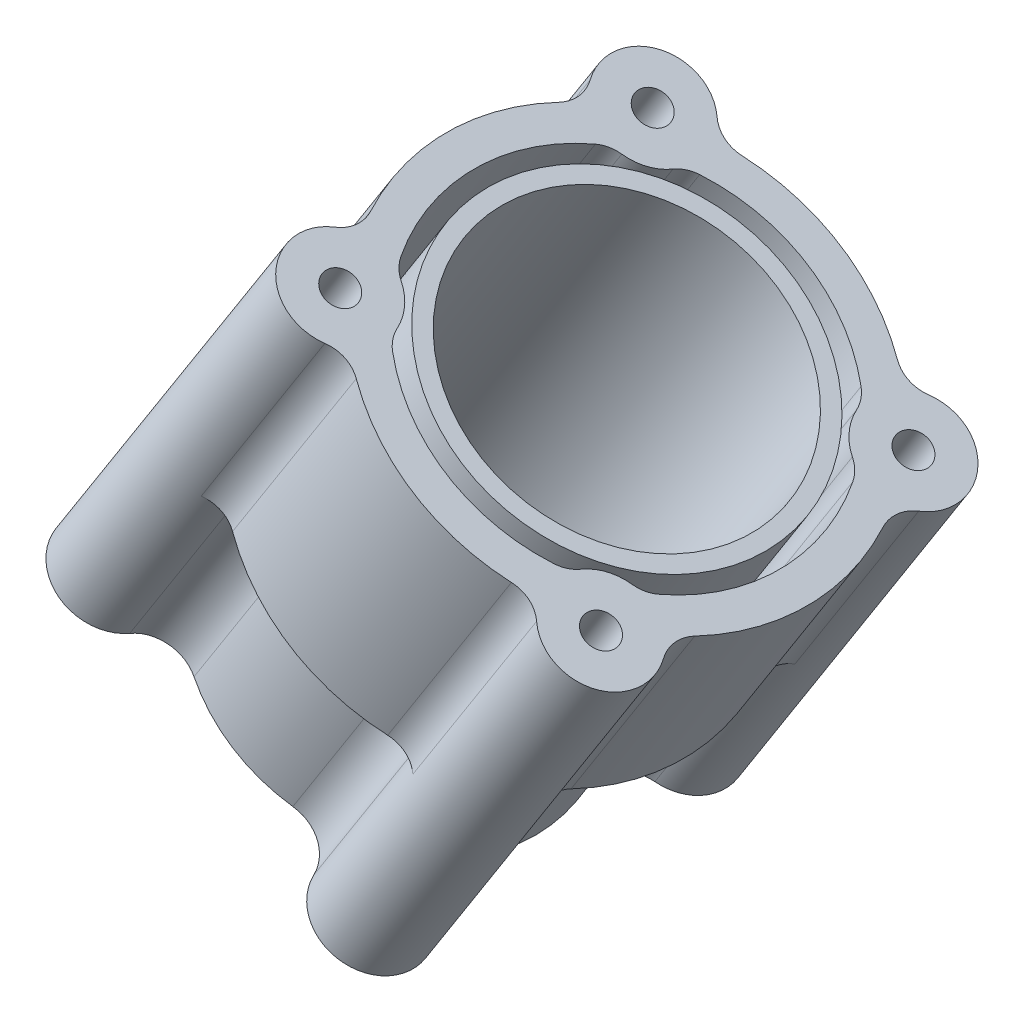
from build123d import *
from build123d.topology import SkipClean

# Parameters (mm, degrees)
BOSS_EXTRUDE1_START   = 100
SKETCH2_R             = 5
BOSS_EXTRUDE1_DEPTH   = 130
SKETCH2_R_2           = 50
SKETCH2_R_3           = 45
BOSS_EXTRUDE1_2_DEPTH = 130
SKETCH3_R             = 100
SKETCH3_R_2           = 50
CUT_EXTRUDE1_DEPTH    = 60
BOSS_EXTRUDE3_START   = 60
SKETCH4_R             = 5
BOSS_EXTRUDE3_DEPTH   = 60


with BuildPart() as part:
    # Sketch2 → Boss-Extrude1 (new body)
    with BuildSketch(Plane(origin=(0, 0, 0), x_dir=(0, 0, -1), z_dir=(0.5372996083468277, 0.8433914458128833, 0)).offset(BOSS_EXTRUDE1_START)):
        with BuildLine():
            ThreePointArc((198.707774346, 59.213708116), (179.337427943, 57.550334456), (177.879118885, 38.163471214))
            ThreePointArc((177.879118885, 38.163471214), (179.755724079, 33.196743881), (178.825393945, 27.96945842))
            ThreePointArc((178.825393945, 27.96945842), (172.5, 0), (178.825393945, -27.96945842))
            ThreePointArc((178.825393945, -27.96945842), (179.755724079, -33.196743881), (177.879118885, -38.163471214))
            ThreePointArc((177.879118885, -38.163471214), (179.337427943, -57.550334456), (198.707774346, -59.213708116))
            ThreePointArc((198.707774346, -59.213708116), (203.694081302, -57.389764479), (208.911229611, -58.375356167))
            ThreePointArc((208.911229611, -58.375356167), (237.5, -65), (266.088770389, -58.375356167))
            ThreePointArc((266.088770389, -58.375356167), (271.305918698, -57.389764479), (276.292225654, -59.213708116))
            ThreePointArc((276.292225654, -59.213708116), (295.662572057, -57.550334456), (297.120881115, -38.163471214))
            ThreePointArc((297.120881115, -38.163471214), (295.244275921, -33.196743881), (296.174606055, -27.96945842))
            ThreePointArc((296.174606055, -27.96945842), (302.5, 0), (296.174606055, 27.96945842))
            ThreePointArc((296.174606055, 27.96945842), (295.244275921, 33.196743881), (297.120881115, 38.163471214))
            ThreePointArc((297.120881115, 38.163471214), (295.662572057, 57.550334456), (276.292225654, 59.213708116))
            ThreePointArc((276.292225654, 59.213708116), (271.305918698, 57.389764479), (266.088770389, 58.375356167))
            ThreePointArc((266.088770389, 58.375356167), (237.5, 65), (208.911229611, 58.375356167))
            ThreePointArc((208.911229611, 58.375356167), (203.694081302, 57.389764479), (198.707774346, 59.213708116))
        make_face()
        with Locations(Location((190, -47, 0), (0, 0, 90))):
            Circle(SKETCH2_R, mode=Mode.SUBTRACT)
        with Locations(Location((285, -47, 0), (0, 0, 90))):
            Circle(SKETCH2_R, mode=Mode.SUBTRACT)
        with Locations(Location((190, 47, 0), (0, 0, 90))):
            Circle(SKETCH2_R, mode=Mode.SUBTRACT)
        with Locations(Location((285, 47, 0), (0, 0, 90))):
            Circle(SKETCH2_R, mode=Mode.SUBTRACT)
        with BuildLine():
            ThreePointArc((195.584219919, 33.078200982), (192.883806526, 31.461344995), (190.819707243, 29.085224223))
            ThreePointArc((190.819707243, 29.085224223), (182.5, 0), (190.819707243, -29.085224223))
            ThreePointArc((190.819707243, -29.085224223), (192.883806526, -31.461344995), (195.584219919, -33.078200982))
            ThreePointArc((195.584219919, -33.078200982), (200.662572057, -36.449665544), (203.980110186, -41.56340923))
            ThreePointArc((203.980110186, -41.56340923), (205.568300645, -44.280780541), (207.922446674, -46.369907691))
            ThreePointArc((207.922446674, -46.369907691), (237.5, -55), (267.077553326, -46.369907691))
            ThreePointArc((267.077553326, -46.369907691), (269.431699355, -44.280780541), (271.019889814, -41.56340923))
            ThreePointArc((271.019889814, -41.56340923), (274.337427943, -36.449665544), (279.415780081, -33.078200982))
            ThreePointArc((279.415780081, -33.078200982), (282.116193474, -31.461344995), (284.180292757, -29.085224223))
            ThreePointArc((284.180292757, -29.085224223), (292.5, 0), (284.180292757, 29.085224223))
            ThreePointArc((284.180292757, 29.085224223), (282.116193474, 31.461344995), (279.415780081, 33.078200982))
            ThreePointArc((279.415780081, 33.078200982), (274.337427943, 36.449665544), (271.019889814, 41.56340923))
            ThreePointArc((271.019889814, 41.56340923), (269.431699355, 44.280780541), (267.077553326, 46.369907691))
            ThreePointArc((267.077553326, 46.369907691), (237.5, 55), (207.922446674, 46.369907691))
            ThreePointArc((207.922446674, 46.369907691), (205.568300645, 44.280780541), (203.980110186, 41.56340923))
            ThreePointArc((203.980110186, 41.56340923), (200.662572057, 36.449665544), (195.584219919, 33.078200982))
        make_face(mode=Mode.SUBTRACT)
    extrude(amount=BOSS_EXTRUDE1_DEPTH)

    # Sketch3 → Cut-Extrude1 (cut)
    with BuildSketch(Plane(origin=(53.729960835, 84.339144581, 0), x_dir=(0.8433914458128833, -0.5372996083468277, 0), z_dir=(-0.5372996083468277, -0.8433914458128833, 0))):
        with Locations((0, -237.5)):
            Circle(SKETCH3_R)
        with Locations(Location((0, -237.5, 0), (0, 0, 180))):
            Circle(SKETCH3_R_2, mode=Mode.SUBTRACT)
    extrude(amount=-CUT_EXTRUDE1_DEPTH, mode=Mode.SUBTRACT)



with BuildPart() as body_2:
    # Sketch2 → Boss-Extrude1 2 (new body)
    with BuildSketch(Plane(origin=(0, 0, 0), x_dir=(0, 0, -1), z_dir=(0.5372996083468277, 0.8433914458128833, 0)).offset(BOSS_EXTRUDE1_START)):
        with Locations(Location((237.5, 0, 0), (0, 0, 90))):
            Circle(SKETCH2_R_2)
        with Locations(Location((237.5, 0, 0), (0, 0, 90))):
            Circle(SKETCH2_R_3, mode=Mode.SUBTRACT)
    extrude(amount=BOSS_EXTRUDE1_2_DEPTH)


with BuildPart() as part_1:
    with SkipClean():  # the faces are left unmerged after this step: merging them gives an invalid solid
        add(part.part)

        add(body_2.part)  # Boss-Extrude3 merges body 2
        # Sketch4 → Boss-Extrude3 (add)
        # profile 1 of 4: a face of its own
        with BuildSketch(Plane(origin=(85.967937335, 134.94263133, 0), x_dir=(0.8433914458128833, -0.5372996083468277, 0), z_dir=(-0.5372996083468277, -0.8433914458128833, 0)).offset(BOSS_EXTRUDE3_START)):
            with BuildLine():
                ThreePointArc((-33.164183333, -184.206022338), (-57.550334456, -179.337427943), (-52.940059929, -203.773731813))
                ThreePointArc((-52.940059929, -203.773731813), (-46.613065404, -210.182422478), (-46.525893445, -219.187675212))
                ThreePointArc((-46.525893445, -219.187675212), (-35.16778152, -201.958093144), (-17.818975805, -190.782935652))
                ThreePointArc((-17.818975805, -190.782935652), (-26.822801925, -190.600477562), (-33.164183333, -184.206022338))
            make_face()
            with Locations(Location((-47, -190, 0), (0, 0, 180))):
                Circle(SKETCH4_R, mode=Mode.SUBTRACT)
        # profile 2 of 4: a face of its own
        with BuildSketch(Plane(origin=(85.967937335, 134.94263133, 0), x_dir=(0.8433914458128833, -0.5372996083468277, 0), z_dir=(-0.5372996083468277, -0.8433914458128833, 0)).offset(BOSS_EXTRUDE3_START)):
            with BuildLine():
                ThreePointArc((17.818975805, -190.782935652), (26.822801925, -190.600477562), (33.164183333, -184.206022338))
                ThreePointArc((33.164183333, -184.206022338), (57.550334456, -179.337427943), (52.940059929, -203.773731813))
                ThreePointArc((52.940059929, -203.773731813), (46.613065404, -210.182422478), (46.525893445, -219.187675212))
                ThreePointArc((46.525893445, -219.187675212), (35.16778152, -201.958093144), (17.818975805, -190.782935652))
            make_face()
            with Locations(Location((47, -190, 0), (0, 0, 180))):
                Circle(SKETCH4_R, mode=Mode.SUBTRACT)
        # profile 3 of 4: a face of its own
        with BuildSketch(Plane(origin=(85.967937335, 134.94263133, 0), x_dir=(0.8433914458128833, -0.5372996083468277, 0), z_dir=(-0.5372996083468277, -0.8433914458128833, 0)).offset(BOSS_EXTRUDE3_START)):
            with BuildLine():
                ThreePointArc((17.818975805, -284.217064348), (35.16778152, -273.041906856), (46.525893445, -255.812324788))
                ThreePointArc((46.525893445, -255.812324788), (46.613065404, -264.817577522), (52.940059929, -271.226268187))
                ThreePointArc((52.940059929, -271.226268187), (57.550334456, -295.662572057), (33.164183333, -290.793977662))
                ThreePointArc((33.164183333, -290.793977662), (26.822801925, -284.399522438), (17.818975805, -284.217064348))
            make_face()
            with Locations(Location((47, -285, 0), (0, 0, 180))):
                Circle(SKETCH4_R, mode=Mode.SUBTRACT)
        # profile 4 of 4: a face of its own
        with BuildSketch(Plane(origin=(85.967937335, 134.94263133, 0), x_dir=(0.8433914458128833, -0.5372996083468277, 0), z_dir=(-0.5372996083468277, -0.8433914458128833, 0)).offset(BOSS_EXTRUDE3_START)):
            with BuildLine():
                ThreePointArc((-17.818975805, -284.217064348), (-26.822801925, -284.399522438), (-33.164183333, -290.793977662))
                ThreePointArc((-33.164183333, -290.793977662), (-57.550334456, -295.662572057), (-52.940059929, -271.226268187))
                ThreePointArc((-52.940059929, -271.226268187), (-46.613065404, -264.817577522), (-46.525893445, -255.812324788))
                ThreePointArc((-46.525893445, -255.812324788), (-35.16778152, -273.041906856), (-17.818975805, -284.217064348))
            make_face()
            with Locations(Location((-47, -285, 0), (0, 0, 180))):
                Circle(SKETCH4_R, mode=Mode.SUBTRACT)
        extrude(amount=-BOSS_EXTRUDE3_DEPTH)


solid = part_1.part
